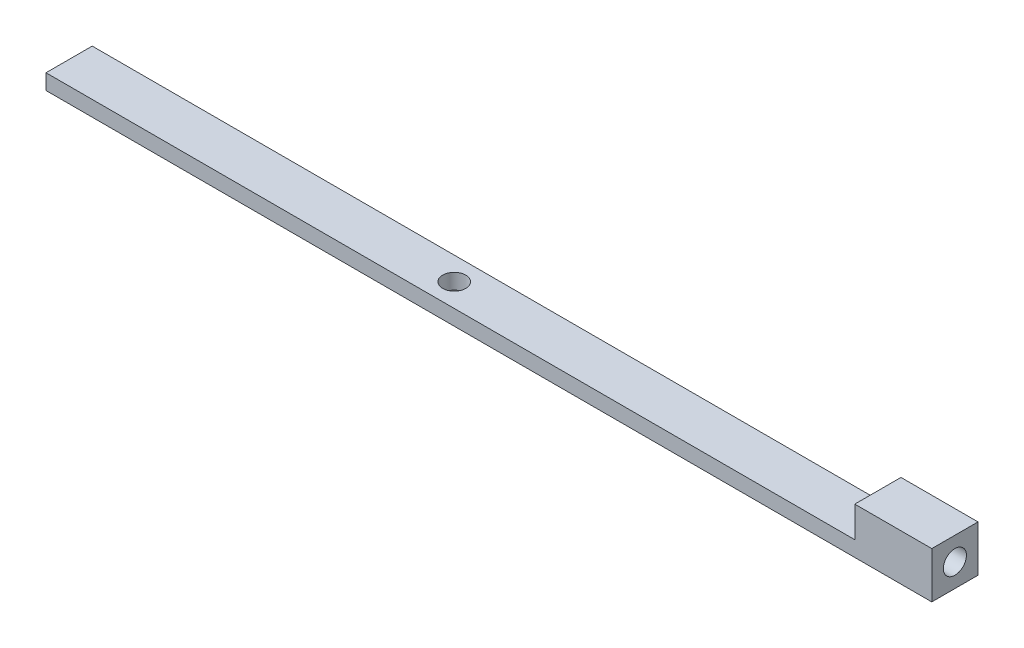
from build123d import *

# Parameters (mm, degrees)
SKETCH1_W           = 125
SKETCH1_H           = 6
BOSS_EXTRUDE1_DEPTH = 4
SKETCH2_R           = 1.15
CUT_EXTRUDE1_DEPTH  = 4
SKETCH4_W           = 6
SKETCH4_H           = 6
BOSS_EXTRUDE2_DEPTH = 10
SKETCH5_R           = 1.25
CUT_EXTRUDE2_DEPTH  = 10
SKETCH6_W           = 125
SKETCH6_H           = 6
CUT_EXTRUDE3_DEPTH  = 2
SKETCH7_R           = 1.5
CUT_EXTRUDE5_DEPTH  = 2
SKETCH8_R           = 1.5
CUT_EXTRUDE6_DEPTH  = 10
SKETCH9_R           = 1.5
CUT_EXTRUDE7_DEPTH  = 10
SKETCH10_W          = 6
SKETCH10_H          = 2
CUT_EXTRUDE8_DEPTH  = 20
SKETCH11_R          = 1.5
BOSS_EXTRUDE3_DEPTH = 2
SKETCH12_R          = 1.5
CUT_EXTRUDE9_DEPTH  = 2


with BuildPart() as part:
    # Sketch1 → Boss-Extrude1 (new body)
    with BuildSketch(Plane(origin=(0, 0, 0), x_dir=(1, 0, 0), z_dir=(0, 1, 0))):
        Rectangle(SKETCH1_W, SKETCH1_H)
    extrude(amount=BOSS_EXTRUDE1_DEPTH)

    # Sketch2 → Cut-Extrude1 (cut)
    with BuildSketch(Plane.XZ):
        with Locations(Location((0, 0, 0), (0, 0, 270))):
            Circle(SKETCH2_R)
    extrude(amount=-CUT_EXTRUDE1_DEPTH, mode=Mode.SUBTRACT)

    # Sketch4 → Boss-Extrude2 (add)
    with BuildSketch(Plane(origin=(62.5, 0, 0), x_dir=(0, 0, -1), z_dir=(1, 0, 0))):
        with Locations((0, 3)):
            Rectangle(SKETCH4_W, SKETCH4_H)
    extrude(amount=BOSS_EXTRUDE2_DEPTH)

    # Sketch5 → Cut-Extrude2 (cut)
    with BuildSketch(Plane(origin=(72.5, 0, 0), x_dir=(0, 0, -1), z_dir=(1, 0, 0))):
        with Locations((0, 3)):
            Circle(SKETCH5_R)
    extrude(amount=-CUT_EXTRUDE2_DEPTH, mode=Mode.SUBTRACT)

    # Sketch6 → Cut-Extrude3 (cut)
    with BuildSketch(Plane(origin=(0, 4, 0), x_dir=(1, 0, 0), z_dir=(0, 1, 0))):
        Rectangle(SKETCH6_W, SKETCH6_H)
    extrude(amount=-CUT_EXTRUDE3_DEPTH, mode=Mode.SUBTRACT)

    # Sketch7 → Cut-Extrude5 (cut)
    with BuildSketch(Plane(origin=(0, 2, 0), x_dir=(1, 0, 0), z_dir=(0, 1, 0))):
        with Locations(Location((0, 0, 0), (0, 0, 270))):
            Circle(SKETCH7_R)
    extrude(amount=-CUT_EXTRUDE5_DEPTH, mode=Mode.SUBTRACT)

    # Sketch8 → Cut-Extrude6 (cut)
    with BuildSketch(Plane(origin=(72.5, 0, 0), x_dir=(0, 0, -1), z_dir=(1, 0, 0))):
        with Locations((0, 3)):
            Circle(SKETCH8_R)
    extrude(amount=-CUT_EXTRUDE6_DEPTH, mode=Mode.SUBTRACT)

    # Sketch9 → Cut-Extrude7 (cut)
    with BuildSketch(Plane(origin=(0, 2, 0), x_dir=(1, 0, 0), z_dir=(0, 1, 0))):
        with Locations(Location((-57.5, 0, 0), (0, 0, 270))):
            Circle(SKETCH9_R)
    extrude(amount=-CUT_EXTRUDE7_DEPTH, mode=Mode.SUBTRACT)

    # Sketch10 → Cut-Extrude8 (cut)
    with BuildSketch(Plane.ZY.offset(62.5)):
        with Locations((0, 1)):
            Rectangle(SKETCH10_W, SKETCH10_H)
    extrude(amount=-CUT_EXTRUDE8_DEPTH, mode=Mode.SUBTRACT)

    # Sketch11 → Boss-Extrude3 (add)
    with BuildSketch(Plane(origin=(0, 2, 0), x_dir=(1, 0, 0), z_dir=(0, 1, 0))):
        Circle(SKETCH11_R)
    extrude(amount=-BOSS_EXTRUDE3_DEPTH)

    # Sketch12 → Cut-Extrude9 (cut)
    with BuildSketch(Plane(origin=(0, 2, 0), x_dir=(1, 0, 0), z_dir=(0, 1, 0))):
        with Locations(Location((7.5, 0, 0), (0, 0, 270))):
            Circle(SKETCH12_R)
    extrude(amount=-CUT_EXTRUDE9_DEPTH, mode=Mode.SUBTRACT)


solid = part.part
